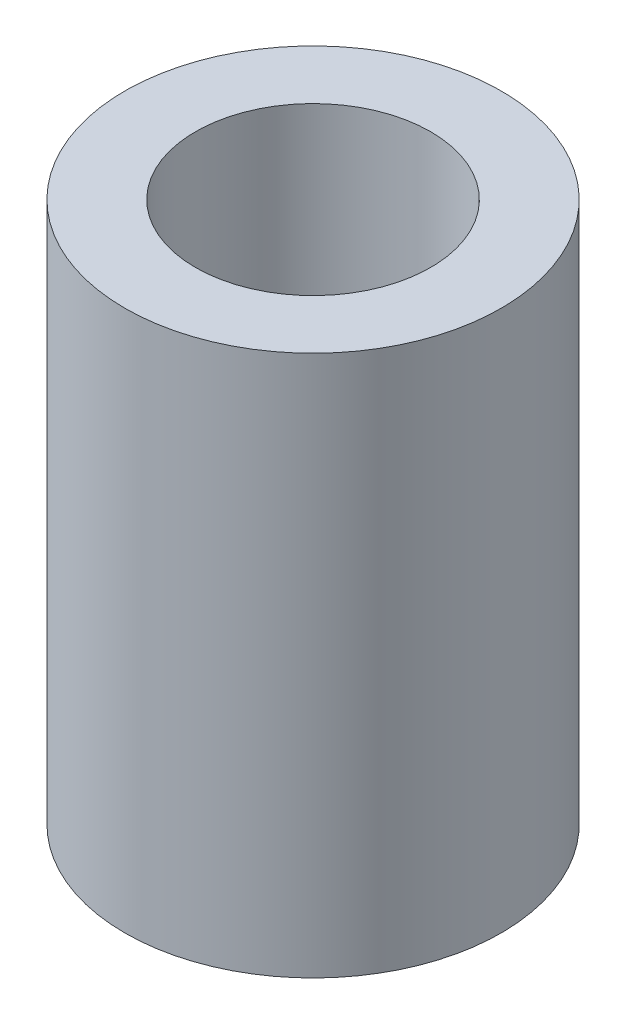
from build123d import *

# Parameters (mm, degrees)
SKETCH1_R           = 8
SKETCH1_R_2         = 5
BOSS_EXTRUDE1_DEPTH = 23


with BuildPart() as part:
    # Sketch1 → Boss-Extrude1 (new body)
    with BuildSketch(Plane(origin=(0, 0, 0), x_dir=(1, 0, 0), z_dir=(0, 1, 0))):
        with Locations(Location((0, 0, 0), (0, 0, 270))):
            Circle(SKETCH1_R)
        with Locations(Location((0, 0, 0), (0, 0, 270))):
            Circle(SKETCH1_R_2, mode=Mode.SUBTRACT)
    extrude(amount=BOSS_EXTRUDE1_DEPTH)


solid = part.part
